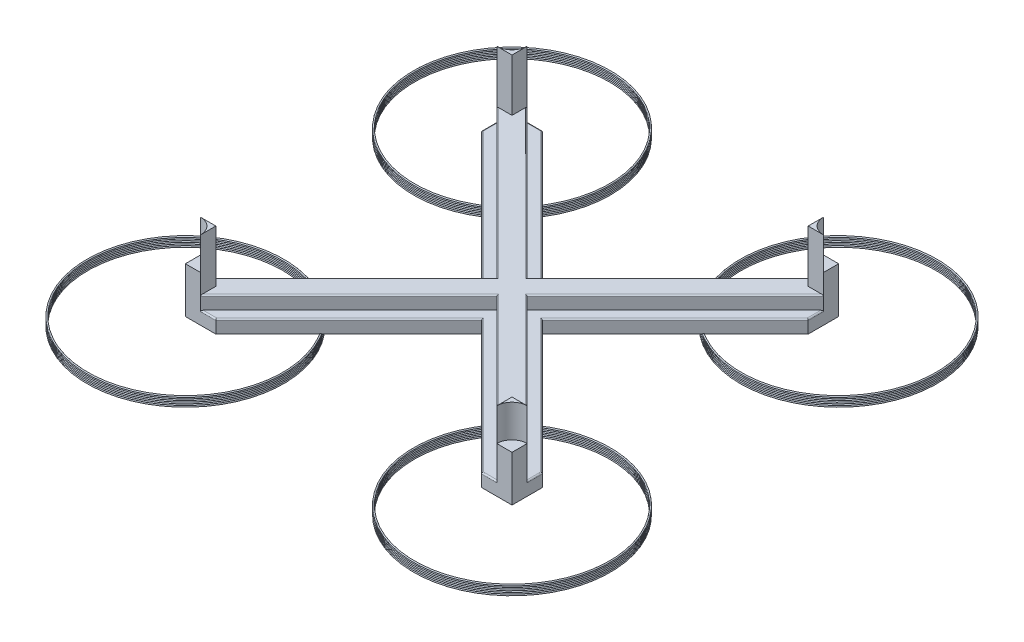
from build123d import *

# Parameters (mm, degrees)
BOSS_EXTRUDE1_DEPTH = 5.08
SKETCH3_W           = 5.918366974
SKETCH3_H           = 5.918366974
BOSS_EXTRUDE2_DEPTH = 38.1
SWEEP11_PROFILE_R   = 0.254
CIRPATTERN1_COUNT   = 4
SKETCH5_R           = 5.918366974
CUT_EXTRUDE1_DEPTH  = 25.4
CIRPATTERN2_COUNT   = 4
SWEEP13_PROFILE_R   = 0.254
CIRPATTERN8_COUNT   = 4
LPATTERN16_COUNT    = 6
LPATTERN16_PITCH    = 0.5588
BOSS_EXTRUDE3_DEPTH = 5.08
FILLET1_R           = 0.508
SKETCH85_W          = 133.692497711
SKETCH85_H          = 133.692497711
CUT_EXTRUDE2_DEPTH  = 12.7


with BuildPart() as part:
    # Sketch1 → Boss-Extrude1 (new body)
    with BuildSketch(Plane(origin=(0, 0, 0), x_dir=(1, 0, 0), z_dir=(0, 1, 0))):
        Polygon((-11.836733948, 0), (-63.5, 51.663266052), (-63.5, 63.5), (-51.663266052, 63.5), (0, 11.836733948), (51.663266052, 63.5), (63.5, 63.5), (63.5, 51.663266052), (11.836733948, 0), (63.5, -51.663266052), (63.5, -63.5), (51.663266052, -63.5), (0, -11.836733948), (-51.663266052, -63.5), (-63.5, -63.5), (-63.5, -51.663266052), align=None)
    extrude(amount=BOSS_EXTRUDE1_DEPTH)

    # Sketch3 → Boss-Extrude2 (add)
    with BuildSketch(Plane(origin=(0, 5.08, 0), x_dir=(1, 0, 0), z_dir=(0, 1, 0))):
        with Locations((-60.540816513, -60.540816513)):
            Rectangle(SKETCH3_W, SKETCH3_H)
        with Locations((60.540816513, 60.540816513)):
            Rectangle(SKETCH3_W, SKETCH3_H)
        with Locations((-60.540816513, 60.540816513)):
            Rectangle(SKETCH3_W, SKETCH3_H)
        with Locations((60.540816513, -60.540816513)):
            Rectangle(SKETCH3_W, SKETCH3_H)
    extrude(amount=BOSS_EXTRUDE2_DEPTH)

    # Sweep11: sweep along a path in Sketch4
    with BuildLine(Plane.XZ) as sweep11_path:
        CenterArc((-63.5, 63.5), 38.1, 0, 360)
    # Sweep11 profile (on start of the path) → Sweep11 (sweep)
    with BuildSketch(Plane(origin=(-25.4, 0, 63.5), x_dir=(1, 0, 0), z_dir=(0, 0, 1))):
        Circle(SWEEP11_PROFILE_R)
    sweep11 = sweep(path=sweep11_path.line)

    # CirPattern1: Sweep11 ×4 about axis
    cirpattern1_axis = Axis((0, 0, 0), (0, 1, 0))
    for i in range(1, CIRPATTERN1_COUNT):
        add(sweep11.rotate(cirpattern1_axis, i * 360 / CIRPATTERN1_COUNT))

    # Sketch5 → Cut-Extrude1 (cut)
    with BuildSketch(Plane(origin=(0, 43.18, 0), x_dir=(1, 0, 0), z_dir=(0, 1, 0))):
        with Locations((63.5, -63.5)):
            Circle(SKETCH5_R)
    cut_extrude1 = extrude(amount=-CUT_EXTRUDE1_DEPTH, mode=Mode.SUBTRACT)

    # CirPattern2: Cut-Extrude1 ×4 about axis
    cirpattern2_axis = Axis((0, 0, 0), (0, 1, 0))
    for i in range(1, CIRPATTERN2_COUNT):
        add(cut_extrude1.rotate(cirpattern2_axis, i * 360 / CIRPATTERN2_COUNT), mode=Mode.SUBTRACT)

    # Sketch84 → Boss-Extrude3 (add)
    with BuildSketch(Plane(origin=(0, 5.08, 0), x_dir=(1, 0, 0), z_dir=(0, 1, 0))):
        Polygon((-57.581633026, 57.581633026), (-63.5, 57.581633026), (-5.918366974, 0), (-63.5, -57.581633026), (-57.581633026, -57.581633026), (-57.581633026, -63.5), (0, -5.918366974), (57.581633026, -63.5), (57.581633026, -57.581633026), (63.5, -57.581633026), (5.918366974, 0), (63.5, 57.581633026), (57.581633026, 57.581633026), (57.581633026, 63.5), (0, 5.918366974), (-57.581633026, 63.5), align=None)
    extrude(amount=BOSS_EXTRUDE3_DEPTH)

    # Fillet1
    fillet1_edges = [part.edges().sort_by_distance(p)[0] for p in [
        (-54.622449539, 5.08, -63.5),
        (-63.5, 5.08, -54.622449539),
        (54.622449539, 5.08, -63.5),
        (63.5, 5.08, -54.622449539),
        (54.622449539, 5.08, 63.5),
        (63.5, 5.08, 54.622449539),
        (-63.5, 5.08, 54.622449539),
        (-54.622449539, 5.08, 63.5),
        (25.831633026, 5.08, -37.668366974),
        (-25.831633026, 5.08, -37.668366974),
        (-37.668366974, 5.08, 25.831633026),
        (-37.668366974, 5.08, -25.831633026),
        (37.668366974, 5.08, 25.831633026),
        (37.668366974, 5.08, -25.831633026),
        (25.831633026, 5.08, 37.668366974),
        (-25.831633026, 5.08, 37.668366974),
        (34.709183487, 10.16, 28.790816513),
        (34.709183487, 10.16, -28.790816513),
        (28.790816513, 10.16, -34.709183487),
        (-28.790816513, 10.16, -34.709183487),
        (-34.709183487, 10.16, -28.790816513),
        (-34.709183487, 10.16, 28.790816513),
        (28.790816513, 10.16, 34.709183487),
        (-28.790816513, 10.16, 34.709183487),
    ]]
    fillet(fillet1_edges, radius=FILLET1_R)

    # Sketch85 → Cut-Extrude2 (cut)
    with BuildSketch(Plane(origin=(0, 43.18, 0), x_dir=(1, 0, 0), z_dir=(0, 1, 0))):
        with Locations((3.346248855, 3.346248855)):
            Rectangle(SKETCH85_W, SKETCH85_H)
    extrude(amount=-CUT_EXTRUDE2_DEPTH, mode=Mode.SUBTRACT)


with BuildPart() as body_2:
    # Sweep13: sweep along a path in Sketch14
    with BuildLine(Plane(origin=(0, -0.508, 0), x_dir=(-1, 0, 0), z_dir=(0, -1, 0))) as sweep13_path:
        CenterArc((63.5, -63.5), 38.1, 0, 360)
    # Sweep13 profile (on start of the path) → Sweep13 (sweep)
    with BuildSketch(Plane(origin=(-101.6, -0.508, 63.5), x_dir=(-1, 0, 0), z_dir=(0, 0, -1))):
        Circle(SWEEP13_PROFILE_R)
    sweep(path=sweep13_path.line)


with BuildPart() as cirpattern8_1:
    # CirPattern8: pattern copy
    add(body_2.part.rotate(Axis((0, 0, 0), (0, 1, 0)), 1 * 360 / CIRPATTERN8_COUNT))


with BuildPart() as cirpattern8_2:
    # CirPattern8: pattern copy
    add(body_2.part.rotate(Axis((0, 0, 0), (0, 1, 0)), 2 * 360 / CIRPATTERN8_COUNT))


with BuildPart() as cirpattern8_3:
    # CirPattern8: pattern copy
    add(body_2.part.rotate(Axis((0, 0, 0), (0, 1, 0)), 3 * 360 / CIRPATTERN8_COUNT))


with BuildPart() as lpattern16_1:
    # LPattern16: pattern copy
    add(cirpattern8_2.part.moved(Location(Vector(0, -1, 0) * (1 * LPATTERN16_PITCH))))


with BuildPart() as lpattern16_2:
    # LPattern16: pattern copy
    add(cirpattern8_2.part.moved(Location(Vector(0, -1, 0) * (2 * LPATTERN16_PITCH))))


with BuildPart() as lpattern16_3:
    # LPattern16: pattern copy
    add(cirpattern8_2.part.moved(Location(Vector(0, -1, 0) * (3 * LPATTERN16_PITCH))))


with BuildPart() as lpattern16_4:
    # LPattern16: pattern copy
    add(cirpattern8_2.part.moved(Location(Vector(0, -1, 0) * (4 * LPATTERN16_PITCH))))


with BuildPart() as lpattern16_5:
    # LPattern16: pattern copy
    add(cirpattern8_2.part.moved(Location(Vector(0, -1, 0) * (5 * LPATTERN16_PITCH))))


with BuildPart() as lpattern16_6:
    # LPattern16: pattern copy
    add(cirpattern8_1.part.moved(Location(Vector(0, -1, 0) * (1 * LPATTERN16_PITCH))))


with BuildPart() as lpattern16_7:
    # LPattern16: pattern copy
    add(cirpattern8_1.part.moved(Location(Vector(0, -1, 0) * (2 * LPATTERN16_PITCH))))


with BuildPart() as lpattern16_8:
    # LPattern16: pattern copy
    add(cirpattern8_1.part.moved(Location(Vector(0, -1, 0) * (3 * LPATTERN16_PITCH))))


with BuildPart() as lpattern16_9:
    # LPattern16: pattern copy
    add(cirpattern8_1.part.moved(Location(Vector(0, -1, 0) * (4 * LPATTERN16_PITCH))))


with BuildPart() as lpattern16_10:
    # LPattern16: pattern copy
    add(cirpattern8_1.part.moved(Location(Vector(0, -1, 0) * (5 * LPATTERN16_PITCH))))


with BuildPart() as lpattern16_11:
    # LPattern16: pattern copy
    add(cirpattern8_3.part.moved(Location(Vector(0, -1, 0) * (1 * LPATTERN16_PITCH))))


with BuildPart() as lpattern16_12:
    # LPattern16: pattern copy
    add(cirpattern8_3.part.moved(Location(Vector(0, -1, 0) * (2 * LPATTERN16_PITCH))))


with BuildPart() as lpattern16_13:
    # LPattern16: pattern copy
    add(cirpattern8_3.part.moved(Location(Vector(0, -1, 0) * (3 * LPATTERN16_PITCH))))


with BuildPart() as lpattern16_14:
    # LPattern16: pattern copy
    add(cirpattern8_3.part.moved(Location(Vector(0, -1, 0) * (4 * LPATTERN16_PITCH))))


with BuildPart() as lpattern16_15:
    # LPattern16: pattern copy
    add(cirpattern8_3.part.moved(Location(Vector(0, -1, 0) * (5 * LPATTERN16_PITCH))))


with BuildPart() as lpattern16_16:
    # LPattern16: pattern copy
    add(body_2.part.moved(Location(Vector(0, -1, 0) * (1 * LPATTERN16_PITCH))))


with BuildPart() as lpattern16_17:
    # LPattern16: pattern copy
    add(body_2.part.moved(Location(Vector(0, -1, 0) * (2 * LPATTERN16_PITCH))))


with BuildPart() as lpattern16_18:
    # LPattern16: pattern copy
    add(body_2.part.moved(Location(Vector(0, -1, 0) * (3 * LPATTERN16_PITCH))))


with BuildPart() as lpattern16_19:
    # LPattern16: pattern copy
    add(body_2.part.moved(Location(Vector(0, -1, 0) * (4 * LPATTERN16_PITCH))))


with BuildPart() as lpattern16_20:
    # LPattern16: pattern copy
    add(body_2.part.moved(Location(Vector(0, -1, 0) * (5 * LPATTERN16_PITCH))))


solid = Compound([part.part, body_2.part, cirpattern8_1.part, cirpattern8_2.part, cirpattern8_3.part, lpattern16_1.part, lpattern16_2.part, lpattern16_3.part, lpattern16_4.part, lpattern16_5.part, lpattern16_6.part, lpattern16_7.part, lpattern16_8.part, lpattern16_9.part, lpattern16_10.part, lpattern16_11.part, lpattern16_12.part, lpattern16_13.part, lpattern16_14.part, lpattern16_15.part, lpattern16_16.part, lpattern16_17.part, lpattern16_18.part, lpattern16_19.part, lpattern16_20.part])
